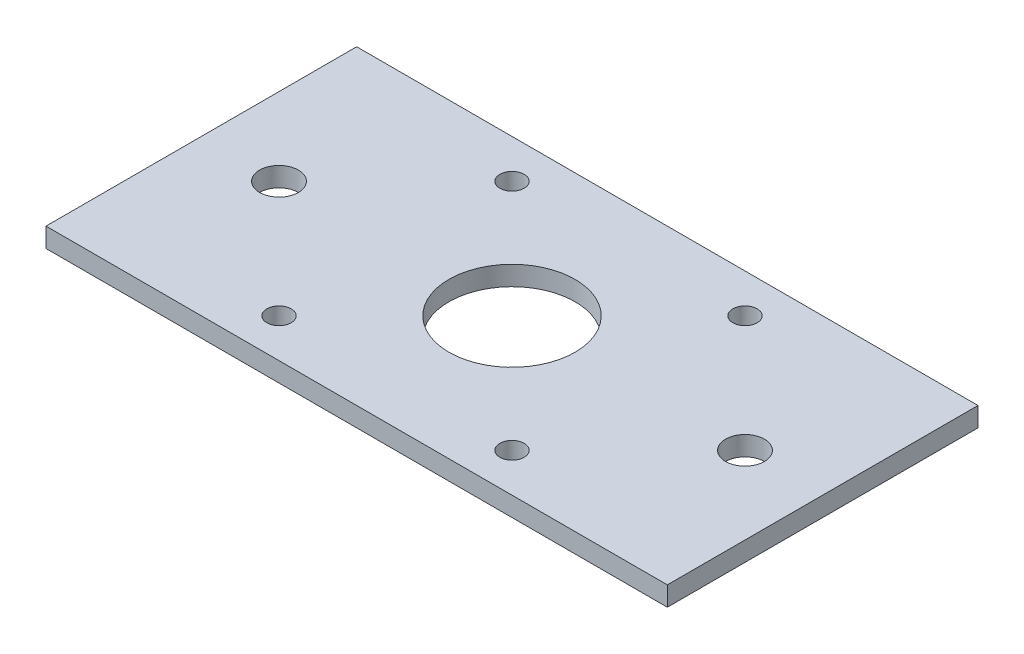
from build123d import *

# Parameters (mm, degrees)
SKETCH1_W                      = 203.2
SKETCH1_H                      = 101.6
BOSS_EXTRUDE1_DEPTH            = 6.35
F_1_2_0_5_DIAMETER_HOLE1_D     = 12.7
F_1_2_0_5_DIAMETER_HOLE1_DEPTH = 25.4
F_1_2_0_5_DIAMETER_HOLE1_TIP   = 3.815464931
SKETCH4_R                      = 20.6375
CUT_EXTRUDE1_DEPTH             = 161.50344791
F_3_8_16_TAPPED_HOLE1_D        = 7.9375
F_3_8_16_TAPPED_HOLE1_DEPTH    = 23.8125
F_3_8_16_TAPPED_HOLE1_TIP      = 2.384665582


with BuildPart() as part:
    # Sketch1 → Boss-Extrude1 (new body)
    with BuildSketch(Plane(origin=(0, 0, 0), x_dir=(1, 0, 0), z_dir=(0, 1, 0))):
        with Locations((42.817129402, 18.947595129)):
            Rectangle(SKETCH1_W, SKETCH1_H)
    extrude(amount=BOSS_EXTRUDE1_DEPTH)

    # 1/2 (0.5) Diameter Hole1
    with Locations(Plane(origin=(-33.382870598, 6.35, -18.947595129), x_dir=(0, 0, 1), z_dir=(0, 1, 0))):
        with Locations((0, 0), (0, 152.4)):
            Hole(F_1_2_0_5_DIAMETER_HOLE1_D / 2, depth=F_1_2_0_5_DIAMETER_HOLE1_DEPTH)
            with Locations((0, 0, -(F_1_2_0_5_DIAMETER_HOLE1_DEPTH + F_1_2_0_5_DIAMETER_HOLE1_TIP / 2))):  # 118° drill point
                Cone(0, F_1_2_0_5_DIAMETER_HOLE1_D / 2, F_1_2_0_5_DIAMETER_HOLE1_TIP, mode=Mode.SUBTRACT)

    # Sketch4 → Cut-Extrude1 (cut, through all)
    with BuildSketch(Plane(origin=(0, 6.35, 0), x_dir=(1, 0, 0), z_dir=(0, 1, 0))):
        with Locations(Location((42.817129402, 18.947595129, 0), (0, 0, 270))):
            Circle(SKETCH4_R)
    extrude(amount=-CUT_EXTRUDE1_DEPTH, mode=Mode.SUBTRACT)

    # 3/8-16 Tapped Hole1
    with Locations(Plane(origin=(4.717129402, 6.35, -57.047595129), x_dir=(0, 0, 1), z_dir=(0, 1, 0))):
        with Locations((0, 0), (0, 76.2), (76.2, 76.2), (76.2, 0)):
            Hole(F_3_8_16_TAPPED_HOLE1_D / 2, depth=F_3_8_16_TAPPED_HOLE1_DEPTH)
            with Locations((0, 0, -(F_3_8_16_TAPPED_HOLE1_DEPTH + F_3_8_16_TAPPED_HOLE1_TIP / 2))):  # 118° drill point
                Cone(0, F_3_8_16_TAPPED_HOLE1_D / 2, F_3_8_16_TAPPED_HOLE1_TIP, mode=Mode.SUBTRACT)


solid = part.part
